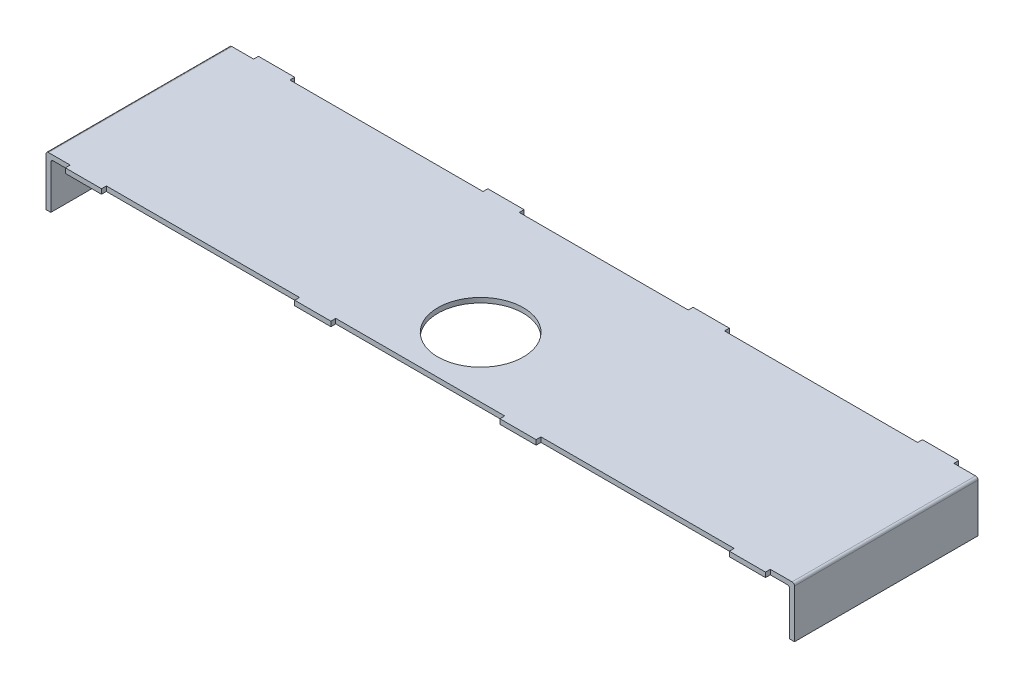
from build123d import *

# Parameters (mm, degrees)
SKETCH_1_R      = 17.7
EXTRUDE_1_DEPTH = 2
SKETCH_2_W      = 2
SKETCH_2_H      = 76
EXTRUDE_2_DEPTH = 19
FILLET_1_R      = 1


with BuildPart() as part:
    # 草图1 → 凸台-拉伸1 (new body)
    with BuildSketch(Plane(origin=(0, 0, 0), x_dir=(1, 0, 0), z_dir=(0, 1, 0))):
        Polygon((-155, -38), (-145, -38), (-145, -40), (-130, -40), (-130, -38), (-50, -38), (-50, -40), (-35, -40), (-35, -38), (35, -38), (35, -40), (50, -40), (50, -38), (130, -38), (130, -40), (145, -40), (145, -38), (155, -38), (155, 38), (145, 38), (145, 40), (130, 40), (130, 38), (50, 38), (50, 40), (35, 40), (35, 38), (-35, 38), (-35, 40), (-50, 40), (-50, 38), (-130, 38), (-130, 40), (-145, 40), (-145, 38), (-155, 38), align=None)
        with Locations(Location((0, -13, 0), (0, 0, 270))):
            Circle(SKETCH_1_R, mode=Mode.SUBTRACT)
    extrude(amount=EXTRUDE_1_DEPTH)

    # 草图2 → 凸台-拉伸2 (add)
    with BuildSketch(Plane.XZ):
        with Locations((154, 0)):
            Rectangle(SKETCH_2_W, SKETCH_2_H)
    extrude_2 = extrude(amount=EXTRUDE_2_DEPTH)

    # 镜向1: 凸台-拉伸2 across plane
    add(extrude_2.mirror(Plane(origin=(0, 0, 0), x_dir=(0, 0, 1), z_dir=(1, 0, 0))))

    # 圆角1
    fillet_1_edges = [part.edges().sort_by_distance(p)[0] for p in [
        (153, 0, 0),
        (155, 2, 0),
        (-153, 0, 0),
        (-155, 2, 0),
    ]]
    fillet(fillet_1_edges, radius=FILLET_1_R)


solid = part.part
